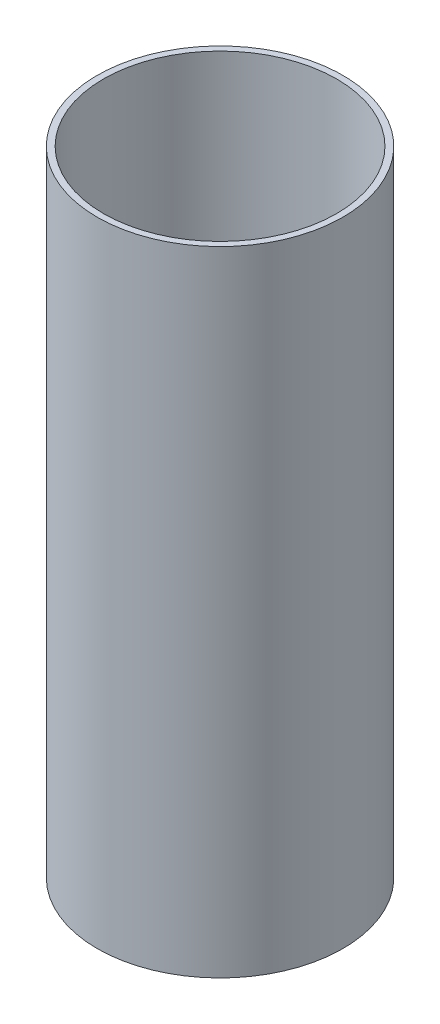
from build123d import *

# Parameters (mm, degrees)
SKETCH1_R           = 93.6625
SKETCH1_R_2         = 88.9
BOSS_EXTRUDE1_DEPTH = 241.427


with BuildPart() as part:
    # Sketch1 → Boss-Extrude1 (new, symmetric)
    with BuildSketch(Plane(origin=(0, 0, 0), x_dir=(1, 0, 0), z_dir=(0, 1, 0))):
        with Locations(Location((0, 0, 0), (0, 0, 270))):
            Circle(SKETCH1_R)
        with Locations(Location((0, 0, 0), (0, 0, 270))):
            Circle(SKETCH1_R_2, mode=Mode.SUBTRACT)
    extrude(amount=BOSS_EXTRUDE1_DEPTH, both=True)


solid = part.part
